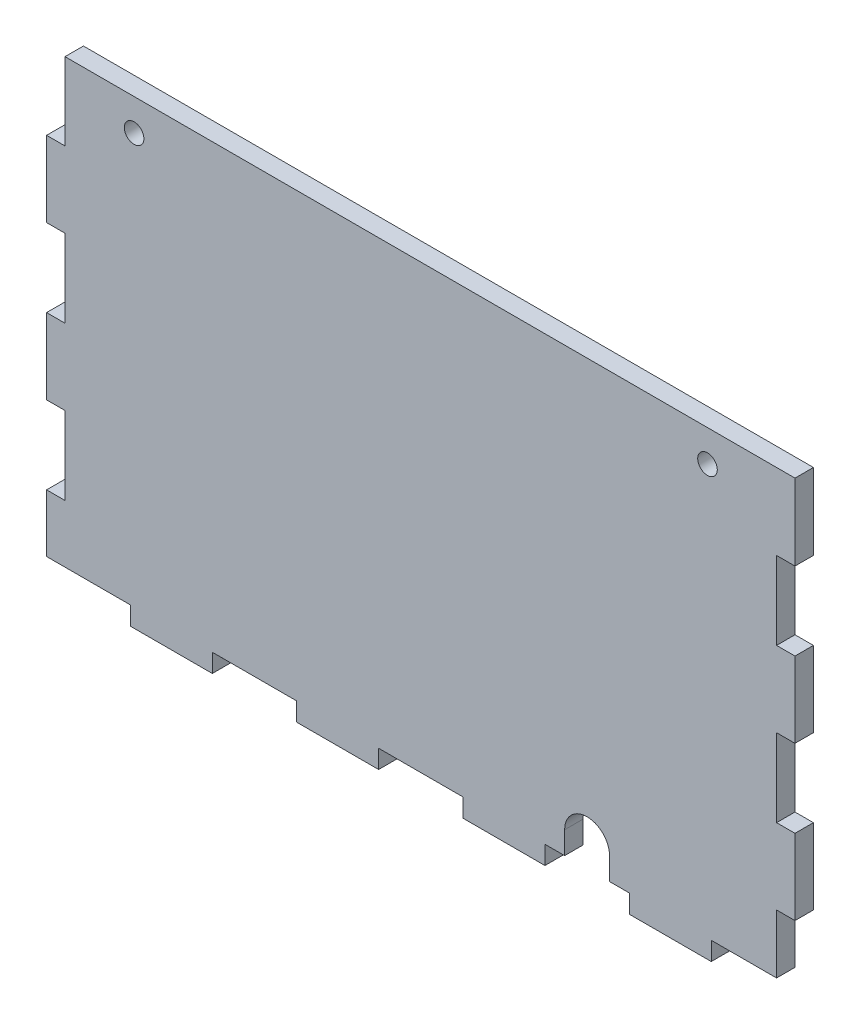
from build123d import *

# Parameters (mm, degrees)
SKETCH1_W           = 130
SKETCH1_H           = 80
BOSS_EXTRUDE1_DEPTH = 3.2
SKETCH2_W           = 14.444444444
SKETCH2_H           = 3.2
SKETCH2_W_2         = 3.2
SKETCH2_H_2         = 13.333333334
SKETCH2_H_3         = 13.333333333
CUT_EXTRUDE1_DEPTH  = 153.676913775
MOVE_FACE1_BY       = 0.1
MOVE_FACE1_2_BY     = 0.1
MOVE_FACE1_3_BY     = 0.1
MOVE_FACE1_4_BY     = 0.1
MOVE_FACE1_5_BY     = 0.1
MOVE_FACE1_6_BY     = 0.1
MOVE_FACE1_7_BY     = 0.1
MOVE_FACE1_8_BY     = 0.1
MOVE_FACE1_9_BY     = 0.1
MOVE_FACE1_10_BY    = 0.1
MOVE_FACE1_11_BY    = 0.1
MOVE_FACE1_12_BY    = 0.1
MOVE_FACE1_13_BY    = 0.1
MOVE_FACE1_14_BY    = 0.1
MOVE_FACE1_15_BY    = 0.1
MOVE_FACE1_16_BY    = 0.1
MOVE_FACE1_17_BY    = 0.1
MOVE_FACE1_18_BY    = 0.1
CUT_EXTRUDE2_REACH  = 154.677
SKETCH3_R           = 1.7
CUT_EXTRUDE3_REACH  = 154.677


with BuildPart() as part:
    # Sketch1 → Boss-Extrude1 (new body)
    with BuildSketch(Plane.XY):
        with Locations((65, 40)):
            Rectangle(SKETCH1_W, SKETCH1_H)
    extrude(amount=BOSS_EXTRUDE1_DEPTH)

    # Sketch2 → Cut-Extrude1 (cut, through all)
    with BuildSketch(Plane.XY.offset(3.2)):
        with Locations((7.222222222, 1.6)):
            Rectangle(SKETCH2_W, SKETCH2_H)
        with Locations((36.111111111, 1.6)):
            Rectangle(SKETCH2_W, SKETCH2_H)
        with Locations((65, 1.6)):
            Rectangle(SKETCH2_W, SKETCH2_H)
        with Locations((93.888888889, 1.6)):
            Rectangle(SKETCH2_W, SKETCH2_H)
        Polygon((115.555555556, 0), (115.555555556, 3.2), (126.8, 3.2), (126.8, 13.333333333), (130, 13.333333333), (130, 0), align=None)
        with Locations((1.6, 20)):
            Rectangle(SKETCH2_W_2, SKETCH2_H_2)
        with Locations((1.6, 46.666666667)):
            Rectangle(SKETCH2_W_2, SKETCH2_H_3)
        with Locations((1.6, 73.333333334)):
            Rectangle(SKETCH2_W_2, SKETCH2_H_3)
        with Locations((128.4, 33.333333334)):
            Rectangle(SKETCH2_W_2, SKETCH2_H_3)
        with Locations((128.4, 60)):
            Rectangle(SKETCH2_W_2, SKETCH2_H_2)
    extrude(amount=-CUT_EXTRUDE1_DEPTH, mode=Mode.SUBTRACT)

    # Move Face1: a face moved inward by 0.1
    extrude(part.faces().sort_by_distance((128.4, 53.333333333, 1.6))[0], amount=MOVE_FACE1_BY, dir=(0, -1, 0), mode=Mode.SUBTRACT)

    # Move Face1 2: a face moved inward by 0.1
    extrude(part.faces().sort_by_distance((128.4, 26.666666667, 1.6))[0], amount=MOVE_FACE1_2_BY, dir=(0, -1, 0), mode=Mode.SUBTRACT)

    # Move Face1 3: a face moved inward by 0.1
    extrude(part.faces().sort_by_distance((128.4, 13.333333333, 1.6))[0], amount=MOVE_FACE1_3_BY, dir=(0, 1, 0), mode=Mode.SUBTRACT)

    # Move Face1 4: a face moved inward by 0.1
    extrude(part.faces().sort_by_distance((128.4, 40, 1.6))[0], amount=MOVE_FACE1_4_BY, dir=(0, 1, 0), mode=Mode.SUBTRACT)

    # Move Face1 5: a face moved inward by 0.1
    extrude(part.faces().sort_by_distance((128.4, 66.666666667, 1.6))[0], amount=MOVE_FACE1_5_BY, dir=(0, 1, 0), mode=Mode.SUBTRACT)

    # Move Face1 6: a face moved inward by 0.1
    extrude(part.faces().sort_by_distance((115.555555556, 1.6, 1.6))[0], amount=MOVE_FACE1_6_BY, dir=(-1, 0, 0), mode=Mode.SUBTRACT)

    # Move Face1 7: a face moved inward by 0.1
    extrude(part.faces().sort_by_distance((86.666666667, 1.6, 1.6))[0], amount=MOVE_FACE1_7_BY, dir=(-1, 0, 0), mode=Mode.SUBTRACT)

    # Move Face1 8: a face moved inward by 0.1
    extrude(part.faces().sort_by_distance((57.777777778, 1.6, 1.6))[0], amount=MOVE_FACE1_8_BY, dir=(-1, 0, 0), mode=Mode.SUBTRACT)

    # Move Face1 9: a face moved inward by 0.1
    extrude(part.faces().sort_by_distance((28.888888889, 1.6, 1.6))[0], amount=MOVE_FACE1_9_BY, dir=(-1, 0, 0), mode=Mode.SUBTRACT)

    # Move Face1 10: a face moved inward by 0.1
    extrude(part.faces().sort_by_distance((14.444444444, 1.6, 1.6))[0], amount=MOVE_FACE1_10_BY, dir=(1, 0, 0), mode=Mode.SUBTRACT)

    # Move Face1 11: a face moved inward by 0.1
    extrude(part.faces().sort_by_distance((43.333333333, 1.6, 1.6))[0], amount=MOVE_FACE1_11_BY, dir=(1, 0, 0), mode=Mode.SUBTRACT)

    # Move Face1 12: a face moved inward by 0.1
    extrude(part.faces().sort_by_distance((72.222222222, 1.6, 1.6))[0], amount=MOVE_FACE1_12_BY, dir=(1, 0, 0), mode=Mode.SUBTRACT)

    # Move Face1 13: a face moved inward by 0.1
    extrude(part.faces().sort_by_distance((101.111111111, 1.6, 1.6))[0], amount=MOVE_FACE1_13_BY, dir=(1, 0, 0), mode=Mode.SUBTRACT)

    # Move Face1 14: a face moved inward by 0.1
    extrude(part.faces().sort_by_distance((1.6, 26.666666667, 1.6))[0], amount=MOVE_FACE1_14_BY, dir=(0, 1, 0), mode=Mode.SUBTRACT)

    # Move Face1 15: a face moved inward by 0.1
    extrude(part.faces().sort_by_distance((1.6, 13.333333333, 1.6))[0], amount=MOVE_FACE1_15_BY, dir=(0, -1, 0), mode=Mode.SUBTRACT)

    # Move Face1 16: a face moved inward by 0.1
    extrude(part.faces().sort_by_distance((1.6, 40, 1.6))[0], amount=MOVE_FACE1_16_BY, dir=(0, -1, 0), mode=Mode.SUBTRACT)

    # Move Face1 17: a face moved inward by 0.1
    extrude(part.faces().sort_by_distance((1.6, 53.333333333, 1.6))[0], amount=MOVE_FACE1_17_BY, dir=(0, 1, 0), mode=Mode.SUBTRACT)

    # Move Face1 18: a face moved inward by 0.1
    extrude(part.faces().sort_by_distance((1.6, 66.666666667, 1.6))[0], amount=MOVE_FACE1_18_BY, dir=(0, -1, 0), mode=Mode.SUBTRACT)

    # Sketch3 → Cut-Extrude2 (cut, up to next)
    with BuildSketch(Plane.XY.offset(3.2), mode=Mode.PRIVATE) as cut_extrude2_sk1:
        with Locations((15.2, 74.5)):
            Circle(SKETCH3_R)
    cut_extrude2_tool1 = extrude(cut_extrude2_sk1.sketch, amount=-CUT_EXTRUDE2_REACH, mode=Mode.PRIVATE) & part.part
    # Sketch3 → Cut-Extrude2 (cut, up to next)
    with BuildSketch(Plane.XY.offset(3.2), mode=Mode.PRIVATE) as cut_extrude2_sk2:
        with Locations(Location((114.8, 74.5, 0), (0, 0, 180))):
            Circle(SKETCH3_R)
    cut_extrude2_tool2 = extrude(cut_extrude2_sk2.sketch, amount=-CUT_EXTRUDE2_REACH, mode=Mode.PRIVATE) & part.part
    add(cut_extrude2_tool1.solids().sort_by_distance((15.2, 74.5, 3.2))[0], mode=Mode.SUBTRACT)
    add(cut_extrude2_tool2.solids().sort_by_distance((114.8, 74.5, 3.2))[0], mode=Mode.SUBTRACT)

    # Sketch4 → Cut-Extrude3 (cut, up to next)
    with BuildSketch(Plane(origin=(0, 0, 0), x_dir=(-1, 0, 0), z_dir=(0, 0, -1)), mode=Mode.PRIVATE) as cut_extrude3_sk1:
        with BuildLine():
            Line((-97.788888889, 3.2), (-97.788888889, 7.1))
            ThreePointArc((-97.788888889, 7.1), (-93.888888889, 11), (-89.988888889, 7.1))
            Line((-89.988888889, 7.1), (-89.988888889, 3.2))
            Line((-89.988888889, 3.2), (-97.788888889, 3.2))
        make_face()
    cut_extrude3_tool1 = extrude(cut_extrude3_sk1.sketch, amount=-CUT_EXTRUDE3_REACH, mode=Mode.PRIVATE) & part.part
    add(cut_extrude3_tool1.solids().sort_by_distance((93.888889, 6.735936, 0))[0], mode=Mode.SUBTRACT)


solid = part.part
